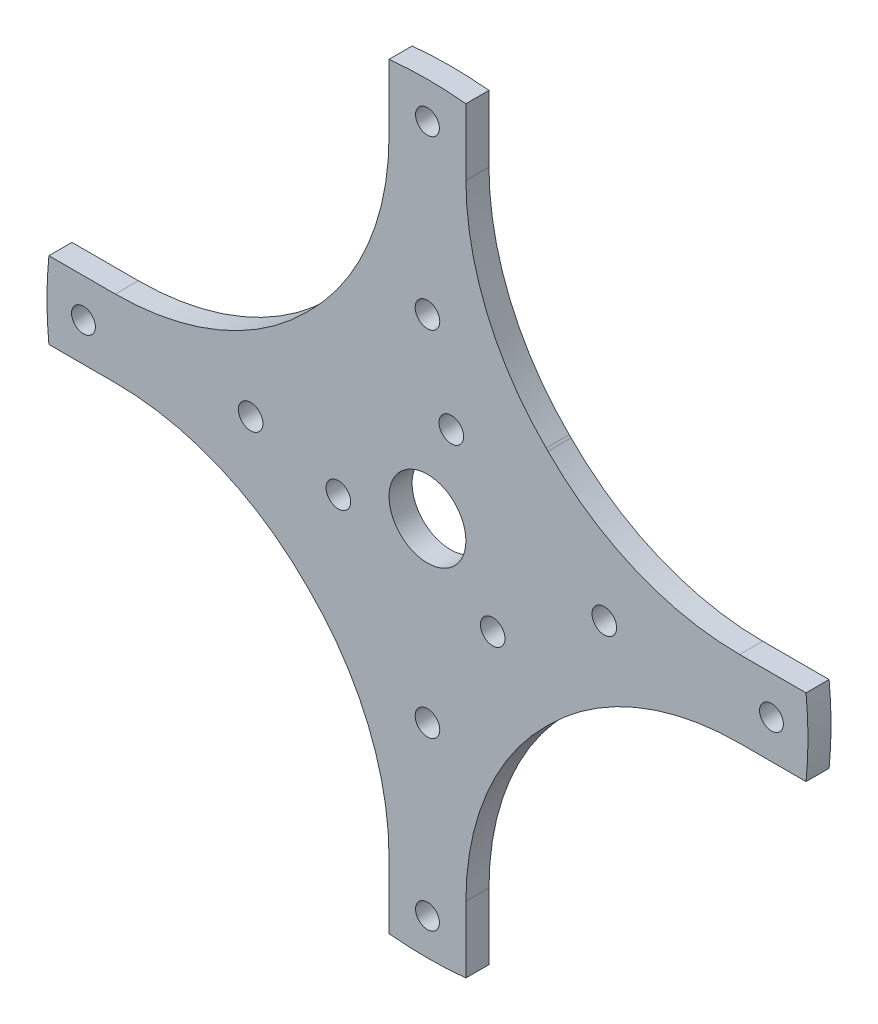
from build123d import *

# Parameters (mm, degrees)
SKETCH_1_R          = 1.55
SKETCH_1_R_2        = 5
SKETCH_1_R_3        = 1.6
EXTRUDE_1_DEPTH     = 3
FILLET_1_R          = 35
SKETCH_2_R          = 1.6
CUT_EXTRUDE_1_DEPTH = 14


with BuildPart() as part:
    # 草图1 → 凸台-拉伸1 (new body)
    with BuildSketch(Plane.XY):
        with BuildLine():
            Line((49.246827309, 5), (21.424285286, 5))
            ThreePointArc((21.424285286, 5), (15.556349186, 15.556349186), (5, 21.424285286))
            Line((5, 21.424285286), (5, 49.246827309))
            ThreePointArc((5, 49.246827309), (0, 49.5), (-5, 49.246827309))
            Line((-5, 49.246827309), (-5, 21.424285286))
            ThreePointArc((-5, 21.424285286), (-15.556349186, 15.556349186), (-21.424285286, 5))
            Line((-21.424285286, 5), (-49.246827309, 5))
            ThreePointArc((-49.246827309, 5), (-49.5, 0), (-49.246827309, -5))
            Line((-49.246827309, -5), (-21.424285286, -5))
            ThreePointArc((-21.424285286, -5), (-15.556349186, -15.556349186), (-5, -21.424285286))
            Line((-5, -21.424285286), (-5, -49.246827309))
            ThreePointArc((-5, -49.246827309), (0, -49.5), (5, -49.246827309))
            Line((5, -49.246827309), (5, -21.424285286))
            ThreePointArc((5, -21.424285286), (15.556349186, -15.556349186), (21.424285286, -5))
            Line((21.424285286, -5), (49.246827309, -5))
            ThreePointArc((49.246827309, -5), (49.5, 0), (49.246827309, 5))
        make_face()
        with Locations((-44.75, 0)):
            Circle(SKETCH_1_R, mode=Mode.SUBTRACT)
        Circle(SKETCH_1_R_2, mode=Mode.SUBTRACT)
        with Locations((0, 44.75)):
            Circle(SKETCH_1_R, mode=Mode.SUBTRACT)
        with Locations((44.75, 0)):
            Circle(SKETCH_1_R, mode=Mode.SUBTRACT)
        with Locations((0, -44.75)):
            Circle(SKETCH_1_R, mode=Mode.SUBTRACT)
        with Locations((3.105828541, 11.591109915)):
            Circle(SKETCH_1_R_3, mode=Mode.SUBTRACT)
        with Locations((8.485281374, -8.485281374)):
            Circle(SKETCH_1_R_3, mode=Mode.SUBTRACT)
        with Locations((-11.591109915, -3.105828541)):
            Circle(SKETCH_1_R_3, mode=Mode.SUBTRACT)
    extrude(amount=EXTRUDE_1_DEPTH)

    # 圆角1
    fillet_1_edges = [part.edges().sort_by_distance(p)[0] for p in [
        (5, 21.424285286, 1.5),
        (21.424285286, 5, 1.5),
        (21.424285286, -5, 1.5),
        (5, -21.424285286, 1.5),
        (-5, -21.424285286, 1.5),
        (-21.424285286, -5, 1.5),
        (-21.424285286, 5, 1.5),
        (-5, 21.424285286, 1.5),
    ]]
    fillet(fillet_1_edges, radius=FILLET_1_R)

    # 草图2 → 切除-拉伸1 (cut)
    with BuildSketch(Plane.XY.offset(3)):
        with Locations((-23, 0)):
            Circle(SKETCH_2_R)
        with Locations((0, 23)):
            Circle(SKETCH_2_R)
        with Locations((23, 0)):
            Circle(SKETCH_2_R)
        with Locations((0, -23)):
            Circle(SKETCH_2_R)
    extrude(amount=-CUT_EXTRUDE_1_DEPTH, mode=Mode.SUBTRACT)


solid = part.part
